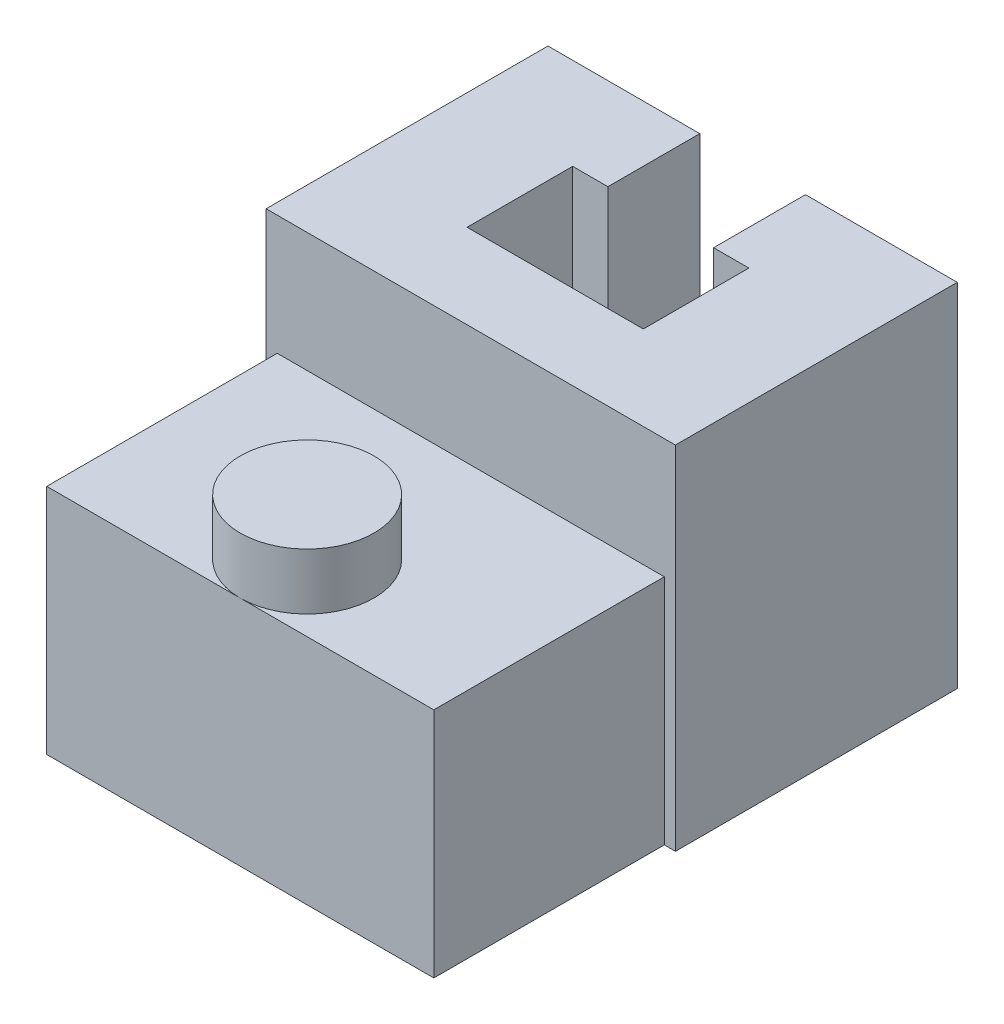
from build123d import *

# Parameters (mm, degrees)
BOSS_EXTRUDE1_DEPTH = 127
SKETCH2_W           = 139.7
SKETCH2_H           = 83.185
BOSS_EXTRUDE2_DEPTH = 83.82
SKETCH3_R           = 24.13
BOSS_EXTRUDE3_DEPTH = 20.32


with BuildPart() as part:
    # Sketch1 → Boss-Extrude1 (new body)
    with BuildSketch(Plane(origin=(0, 0, 0), x_dir=(1, 0, 0), z_dir=(0, 1, 0))):
        Polygon((16.729923946, 28.301454676), (16.729923946, -9.798545324), (80.331523946, -9.798545324), (80.331523946, 28.301454676), (67.606123946, 28.301454676), (67.606123946, 61.448454676), (122.393923946, 61.448454676), (122.393923946, -40.278545324), (-25.332476054, -40.278545324), (-25.332476054, 61.448454676), (29.455323946, 61.448454676), (29.455323946, 28.301454676), align=None)
    extrude(amount=-BOSS_EXTRUDE1_DEPTH)

    # Sketch2 → Boss-Extrude2 (add)
    with BuildSketch(Plane.XZ.offset(127)):
        with Locations((48.530723946, 81.871045324)):
            Rectangle(SKETCH2_W, SKETCH2_H)
    extrude(amount=-BOSS_EXTRUDE2_DEPTH)

    # Sketch3 → Boss-Extrude3 (add)
    with BuildSketch(Plane(origin=(0, -43.18, 0), x_dir=(1, 0, 0), z_dir=(0, 1, 0))):
        with Locations(Location((48.530723946, -99.333545324, 0), (0, 0, 270))):
            Circle(SKETCH3_R)
    extrude(amount=BOSS_EXTRUDE3_DEPTH)


solid = part.part
